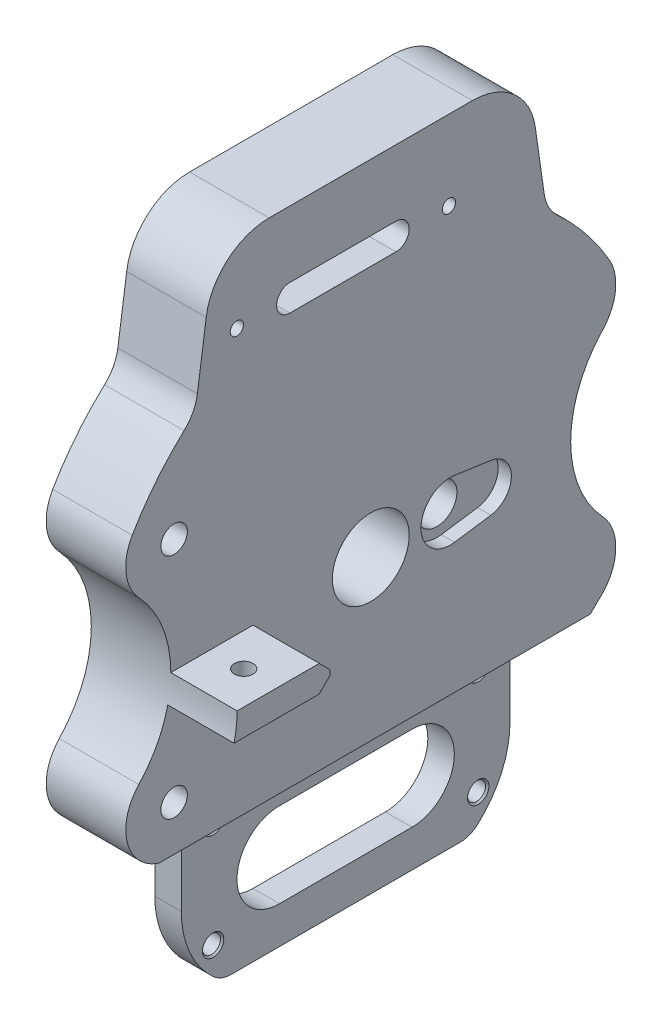
from build123d import *

# Parameters (mm, degrees)
SZKIC1_R                         = 14.5
SZKIC1_R_2                       = 5
DODANIE_WYCI_GNI_CIE1_DEPTH      = 15
M6_TAPPED_HOLE1_D                = 5
DODANIE_WYCI_GNI_CIE3_START      = -25
DODANIE_WYCI_GNI_CIE3_DEPTH      = 25
OTW_R_GWINTOWANY_M8X1_01_D       = 7
OTW_R_GWINTOWANY_M8X1_01_DEPTH   = 18.896987833
OTW_R_GWINTOWANY_M8X1_01_TIP     = 2.103012167
WYTNIJ_WYCI_GNI_CIE2_DEPTH       = 10
WYTNIJ_WYCI_GNI_CIE4_DEPTH       = 20
SFAZOWANIE4_SIZE                 = 10
WYTNIJ_WYCI_GNI_CIE5_DEPTH       = 5
SZKIC17_5_R                      = 7.5
WYTNIJ_WYCI_GNI_CIE6_DEPTH       = 163.311542951
OTW_R_GWINTOWANY_M81_D           = 6.8
OTW_R_GWINTOWANY_M81_DEPTH       = 16.207073895
OTW_R_GWINTOWANY_M81_CSINK_D     = 8.05
OTW_R_GWINTOWANY_M81_CSINK_ANGLE = 90
OTW_R_GWINTOWANY_M81_TIP         = 2.042926105


with BuildPart() as part:
    # Szkic1 → Dodanie-wyciągnięcie1 (new, symmetric)
    with BuildSketch(Plane(origin=(0, 0, 0), x_dir=(0, 0, -1), z_dir=(1, 0, 0))):
        with BuildLine():
            Line((62.076569761, 109.385977671), (65.40069858, 86.060032436))
            ThreePointArc((65.40069858, 86.060032436), (67.080888035, 80.867469231), (70.408575711, 76.541704099))
            ThreePointArc((70.408575711, 76.541704099), (81.115709466, 65.086416999), (89.978943384, 52.151603499))
            ThreePointArc((89.978943384, 52.151603499), (92.32041193, 40.919666146), (87.495806927, 30.50995538))
            ThreePointArc((87.495806927, 30.50995538), (75.419960244, 0), (87.495806927, -30.50995538))
            ThreePointArc((87.495806927, -30.50995538), (92.404294481, -44.130927243), (85.848604083, -57.040111879))
            Line((85.848604083, -57.040111879), (72.530533194, -70))
            Line((72.530533194, -70), (72.530533194, -100))
            ThreePointArc((72.530533194, -100), (69.358641969, -114.988630917), (60.386800396, -127.407407407))
            ThreePointArc((60.386800396, -127.407407407), (57.269301841, -129.329364235), (53.668890342, -130))
            Line((53.668890342, -130), (35.530533194, -130))
            Line((35.530533194, -130), (-14.469466806, -130))
            Line((-14.469466806, -130), (-32.607823953, -130))
            ThreePointArc((-32.607823953, -130), (-36.208235452, -129.329364235), (-39.325734007, -127.407407407))
            ThreePointArc((-39.325734007, -127.407407407), (-48.29757558, -114.988630917), (-51.469466806, -100))
            Line((-51.469466806, -100), (-51.469466806, -70))
            Line((-51.469466806, -70), (-81.240664282, -59.524081957))
            ThreePointArc((-81.240664282, -59.524081957), (-92.006314233, -46.663708643), (-87.495806927, -30.50995538))
            ThreePointArc((-87.495806927, -30.50995538), (-75.419960244, 0), (-87.495806927, 30.50995538))
            ThreePointArc((-87.495806927, 30.50995538), (-92.32041193, 40.919666146), (-89.978943384, 52.151603499))
            ThreePointArc((-89.978943384, 52.151603499), (-81.115709466, 65.086416999), (-70.408575711, 76.541704099))
            ThreePointArc((-70.408575711, 76.541704099), (-67.080888035, 80.867469231), (-65.40069858, 86.060032436))
            Line((-65.40069858, 86.060032436), (-62.076569761, 109.385977671))
            ThreePointArc((-62.076569761, 109.385977671), (-54.044566654, 124.12820267), (-38.316621209, 130))
            Line((-38.316621209, 130), (38.316621209, 130))
            ThreePointArc((38.316621209, 130), (54.044566654, 124.12820267), (62.076569761, 109.385977671))
        make_face()
        Circle(SZKIC1_R, mode=Mode.SUBTRACT)
        with Locations((-74.189369185, 43)):
            Circle(SZKIC1_R_2, mode=Mode.SUBTRACT)
        with Locations((-74.189369185, -43)):
            Circle(SZKIC1_R_2, mode=Mode.SUBTRACT)
        with BuildLine():
            Line((-14.469466806, -84), (35.530533194, -84))
            ThreePointArc((35.530533194, -84), (51.530533194, -100), (35.530533194, -116))
            Line((35.530533194, -116), (-14.469466806, -116))
            ThreePointArc((-14.469466806, -116), (-30.469466806, -100), (-14.469466806, -84))
        make_face(mode=Mode.SUBTRACT)
    extrude(amount=DODANIE_WYCI_GNI_CIE1_DEPTH, both=True)

    # M6 Tapped Hole1 (through all)
    with Locations(Plane(origin=(15, 0, 0), x_dir=(0, 0, -1), z_dir=(1, 0, 0))):
        with Locations((-50.510423527, 100), (29.489576473, 100)):
            Hole(M6_TAPPED_HOLE1_D / 2)

    # Szkic5 → Dodanie-wyciągnięcie3 (add)
    with BuildSketch(Plane.ZY.offset(-15).offset(DODANIE_WYCI_GNI_CIE3_START)):
        with BuildLine():
            Line((75.419960244, 0), (44.419960244, 0))
            Line((44.419960244, 0), (40.419960244, -4))
            Line((40.419960244, -4), (40.419960244, -6))
            Line((40.419960244, -6), (44.419960244, -10))
            Line((44.419960244, -10), (76.556013712, -10))
            ThreePointArc((76.556013712, -10), (75.704884126, -5.032161998), (75.419960244, 0))
        make_face()
    extrude(amount=DODANIE_WYCI_GNI_CIE3_DEPTH)

    # Otwór gwintowany M8x1.01
    with Locations(Plane(origin=(0, 0, 0), x_dir=(1, 0, 0), z_dir=(0, 1, 0))):
        with Locations((27.5, -60.419960244)):
            Hole(OTW_R_GWINTOWANY_M8X1_01_D / 2, depth=OTW_R_GWINTOWANY_M8X1_01_DEPTH)
            with Locations((0, 0, -(OTW_R_GWINTOWANY_M8X1_01_DEPTH + OTW_R_GWINTOWANY_M8X1_01_TIP / 2))):  # 118° drill point
                Cone(0, OTW_R_GWINTOWANY_M8X1_01_D / 2, OTW_R_GWINTOWANY_M8X1_01_TIP, mode=Mode.SUBTRACT)

    # Szkic12 → Wytnij-wyciągnięcie2 (cut)
    with BuildSketch(Plane(origin=(15, 0, 0), x_dir=(0, 0, -1), z_dir=(1, 0, 0))):
        with BuildLine():
            Line((9.489576473, 105), (-30.510423527, 105))
            ThreePointArc((-30.510423527, 105), (-35.510423527, 100), (-30.510423527, 95))
            Line((-30.510423527, 95), (9.489576473, 95))
            ThreePointArc((9.489576473, 95), (14.489576473, 100), (9.489576473, 105))
        make_face()
    extrude(amount=-WYTNIJ_WYCI_GNI_CIE2_DEPTH, mode=Mode.SUBTRACT)

    # Szkic16 → Wytnij-wyciągnięcie4 (cut)
    with BuildSketch(Plane(origin=(15, 0, 0), x_dir=(0, 0, -1), z_dir=(1, 0, 0))):
        with BuildLine():
            Line((-32.607823953, -130), (53.668890342, -130))
            ThreePointArc((53.668890342, -130), (57.269301841, -129.329364235), (60.386800396, -127.407407407))
            ThreePointArc((60.386800396, -127.407407407), (69.358641969, -114.988630917), (72.530533194, -100))
            Line((72.530533194, -100), (72.530533194, -70))
            Line((72.530533194, -70), (-51.469466806, -70))
            Line((-51.469466806, -70), (-51.469466806, -100))
            ThreePointArc((-51.469466806, -100), (-48.29757558, -114.988630917), (-39.325734007, -127.407407407))
            ThreePointArc((-39.325734007, -127.407407407), (-36.208235452, -129.329364235), (-32.607823953, -130))
        make_face()
        with BuildLine():
            Line((-14.469466806, -116), (35.530533194, -116))
            ThreePointArc((35.530533194, -116), (51.530533194, -100), (35.530533194, -84))
            Line((35.530533194, -84), (-14.469466806, -84))
            ThreePointArc((-14.469466806, -84), (-30.469466806, -100), (-14.469466806, -116))
        make_face(mode=Mode.SUBTRACT)
    extrude(amount=-WYTNIJ_WYCI_GNI_CIE4_DEPTH, mode=Mode.SUBTRACT)

    # Sfazowanie4
    sfazowanie4_edges = [part.edges().sort_by_distance(p)[0] for p in [
        (15, -70, -10.530533194),
    ]]
    chamfer(sfazowanie4_edges, length=SFAZOWANIE4_SIZE)

    # Szkic17 → Wytnij-wyciągnięcie5 (cut)
    with BuildSketch(Plane(origin=(15, 0, 0), x_dir=(0, 0, -1), z_dir=(1, 0, 0))):
        with BuildLine():
            Line((31.578571429, -10.936663671), (45.292857143, -8.957177034))
            ThreePointArc((45.292857143, -8.957177034), (53.05, 0), (45.292857142, 8.957177033))
            Line((45.292857142, 8.957177033), (31.578571428, 10.93666367))
            ThreePointArc((31.578571428, 10.93666367), (22.462605729, 8.080234378), (18.98012619, -0.815402484))
            ThreePointArc((18.98012619, -0.815402484), (23.079412621, -8.614404816), (31.578571429, -10.936663671))
        make_face()
    extrude(amount=-WYTNIJ_WYCI_GNI_CIE5_DEPTH, mode=Mode.SUBTRACT)

    # Szkic17<5> → Wytnij-wyciągnięcie6 (cut, through all)
    with BuildSketch(Plane(origin=(15, 0, 0), x_dir=(0, 0, -1), z_dir=(1, 0, 0))):
        with Locations((30, -1e-09)):
            Circle(SZKIC17_5_R)
    extrude(amount=-WYTNIJ_WYCI_GNI_CIE6_DEPTH, mode=Mode.SUBTRACT)

    # Otwór gwintowany M81
    with Locations(Plane(origin=(-5, -77, 39.469466806), x_dir=(0, 0, 1), z_dir=(1, 0, 0))):
        with Locations((0, 0), (0, 40), (-100, 40), (-100, 0)):
            CounterSinkHole(OTW_R_GWINTOWANY_M81_D / 2, OTW_R_GWINTOWANY_M81_CSINK_D / 2, depth=OTW_R_GWINTOWANY_M81_DEPTH, counter_sink_angle=OTW_R_GWINTOWANY_M81_CSINK_ANGLE)
            with Locations((0, 0, -(OTW_R_GWINTOWANY_M81_DEPTH + OTW_R_GWINTOWANY_M81_TIP / 2))):  # 118° drill point
                Cone(0, OTW_R_GWINTOWANY_M81_D / 2, OTW_R_GWINTOWANY_M81_TIP, mode=Mode.SUBTRACT)


solid = part.part
